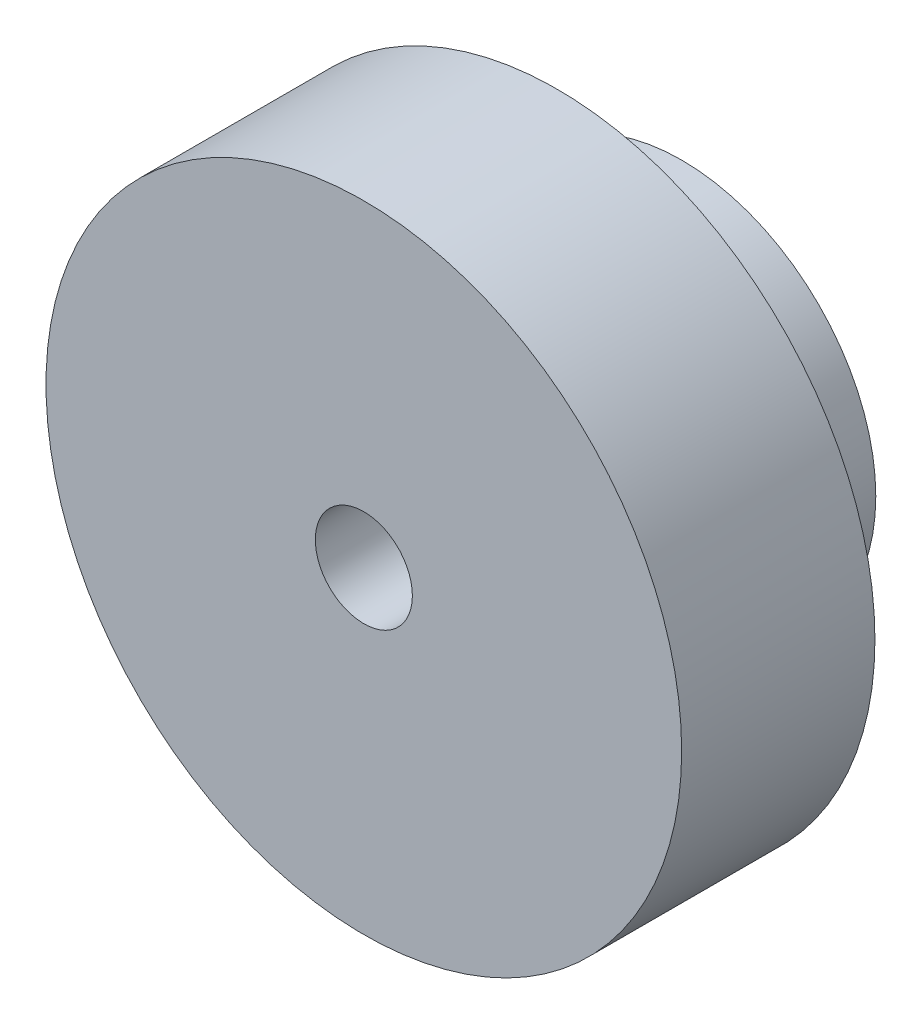
from build123d import *

# Parameters (mm, degrees)
SKETCH1_R           = 9.398
SKETCH1_R_2         = 1.4351
BOSS_EXTRUDE1_DEPTH = 5.715
SKETCH2_R           = 5.7404
BOSS_EXTRUDE2_DEPTH = 3.683


with BuildPart() as part:
    # Sketch1 → Boss-Extrude1 (new body)
    with BuildSketch(Plane.XY):
        Circle(SKETCH1_R)
        Circle(SKETCH1_R_2, mode=Mode.SUBTRACT)
    extrude(amount=BOSS_EXTRUDE1_DEPTH)

    # Sketch2 → Boss-Extrude2 (add)
    with BuildSketch(Plane(origin=(0, 0, 0), x_dir=(-1, 0, 0), z_dir=(0, 0, -1))):
        with Locations(Location((0, 0, 0), (0, 0, 180))):
            Circle(SKETCH2_R)
        Polygon((3.764397664, 3.359086542), (3.359739968, -3.752913458), (-3.752260032, -3.348255763), (-3.347602336, 3.763744237), align=None, mode=Mode.SUBTRACT)
    extrude(amount=BOSS_EXTRUDE2_DEPTH)


solid = part.part
